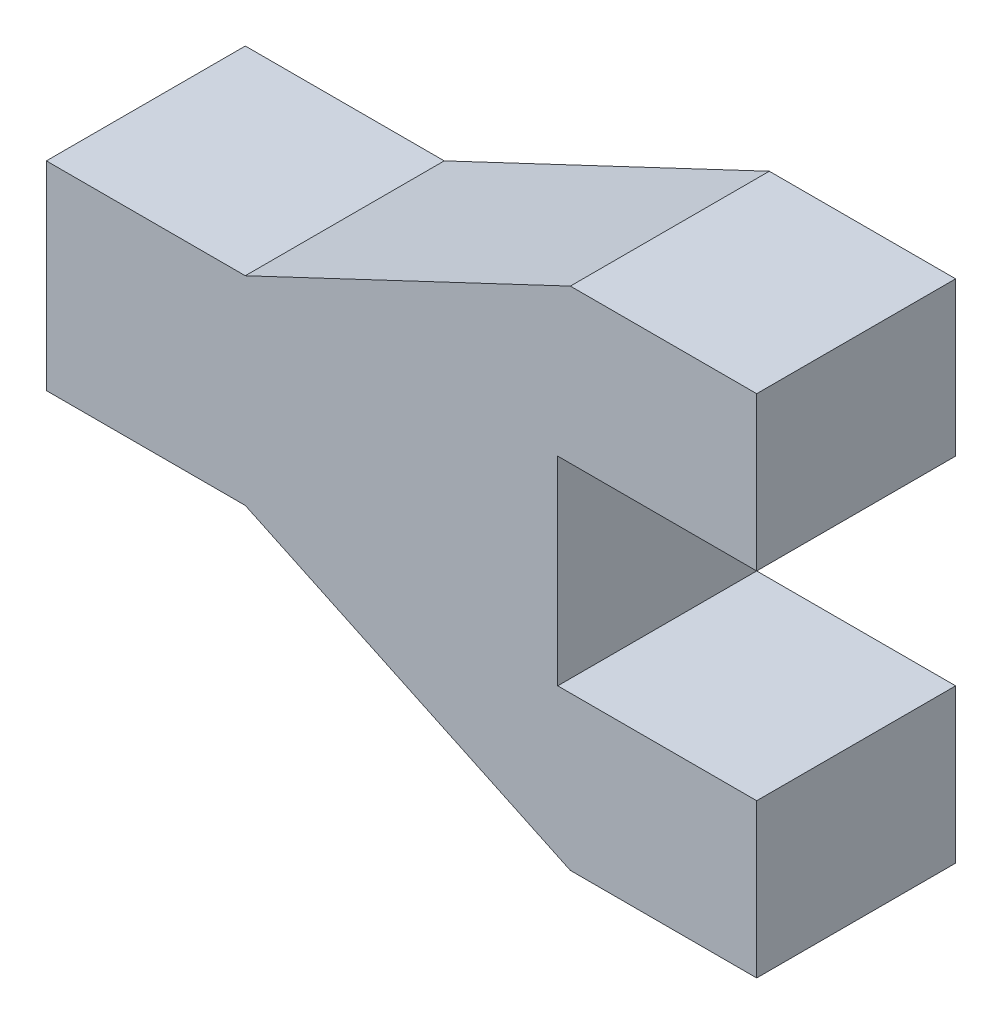
from build123d import *

# Parameters (mm, degrees)
BOSS_EXTRUDE1_DEPTH = 1.524


with BuildPart() as part:
    # Sketch1 → Boss-Extrude1 (new body)
    with BuildSketch(Plane.XY):
        Polygon((66.482285978, -1.524), (66.482285978, -2.700124806), (65.05492566, -2.700124806), (62.565166735, -1.524), (61.041166735, -1.524), (61.041166735, 0), (62.565166735, 0), (65.05492566, 1.176124806), (66.482285978, 1.176124806), (66.482285978, 0), (64.958285978, 0), (64.958285978, -1.524), align=None)
    extrude(amount=BOSS_EXTRUDE1_DEPTH)


solid = part.part
